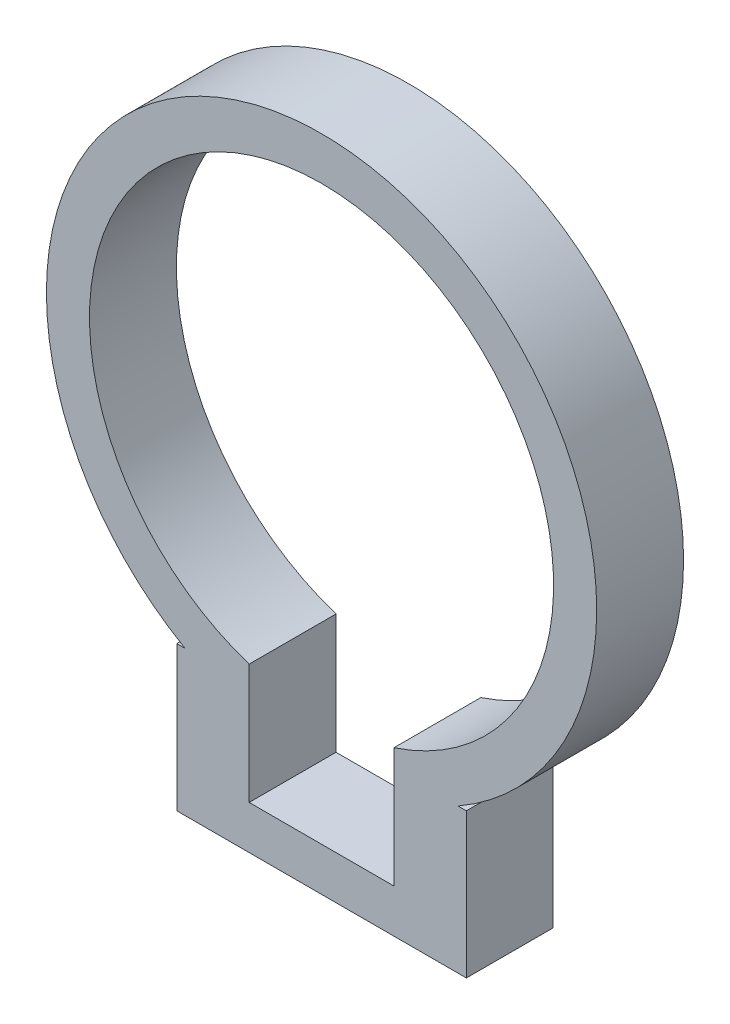
from build123d import *

# Parameters (mm, degrees)
ESQUISSE1_W             = 20
ESQUISSE1_H             = 10
BOSS_EXTRU_1_DEPTH      = 6
ESQUISSE2_R             = 19
BOSS_EXTRU_2_DEPTH      = 6
ESQUISSE3_R             = 16.025
ENL_V_MAT_EXTRU_1_DEPTH = 6
ESQUISSE4_W             = 10
ESQUISSE4_H             = 8.272386128
ENL_V_MAT_EXTRU_2_DEPTH = 10


with BuildPart() as part:
    # Esquisse1 → Boss.-Extru.1 (new body)
    with BuildSketch(Plane.XY):
        Rectangle(ESQUISSE1_W, ESQUISSE1_H)
    extrude(amount=BOSS_EXTRU_1_DEPTH)

    # Esquisse2 → Boss.-Extru.2 (add)
    with BuildSketch(Plane.XY.offset(6)):
        with Locations((0, 21.497386128)):
            Circle(ESQUISSE2_R)
    extrude(amount=-BOSS_EXTRU_2_DEPTH)

    # Esquisse3 → Enlèv. mat.-Extru.1 (cut)
    with BuildSketch(Plane.XY.offset(6)):
        with Locations((0, 21.497386128)):
            Circle(ESQUISSE3_R)
    extrude(amount=-ENL_V_MAT_EXTRU_1_DEPTH, mode=Mode.SUBTRACT)

    # Esquisse4 → Enlèv. mat.-Extru.2 (cut)
    with BuildSketch(Plane.XY.offset(6)):
        with Locations((0, 2.136193064)):
            Rectangle(ESQUISSE4_W, ESQUISSE4_H)
    extrude(amount=-ENL_V_MAT_EXTRU_2_DEPTH, mode=Mode.SUBTRACT)


solid = part.part
